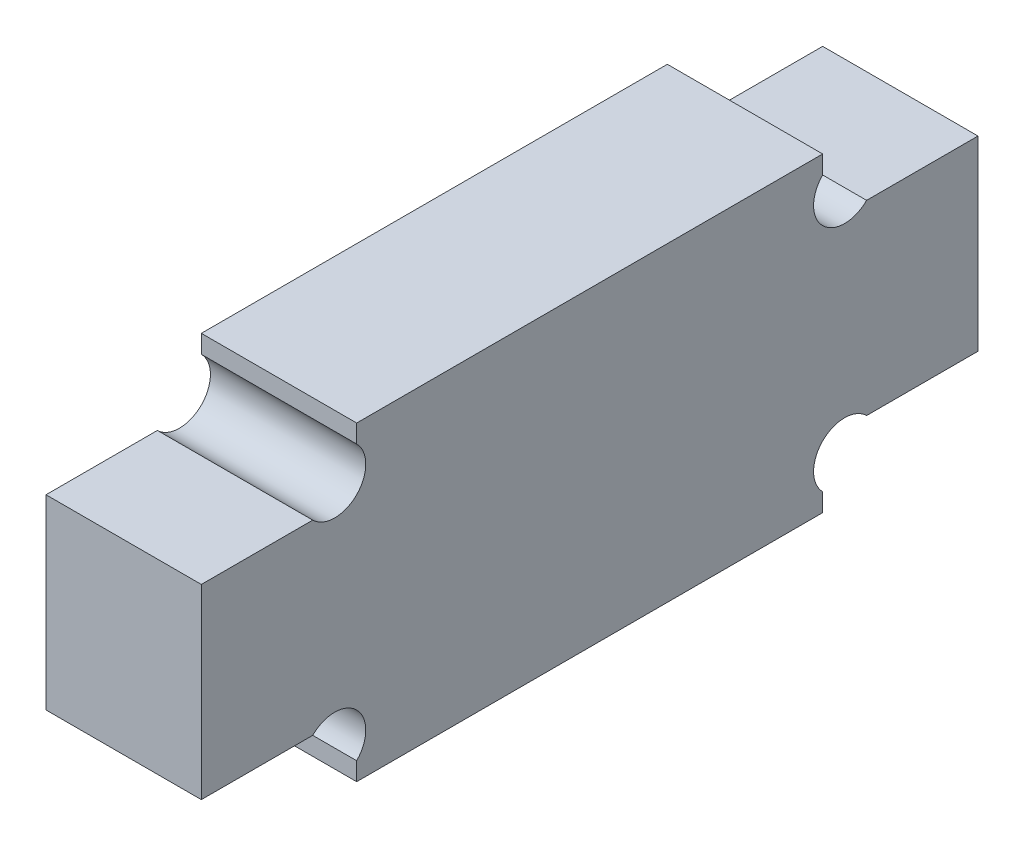
from build123d import *

# Parameters (mm, degrees)
SKETCH_1_W          = 25
SKETCH_1_H          = 10
EXTRUDE_1_DEPTH     = 5
SKETCH_2_W          = 5
SKETCH_2_H          = 2
CUT_EXTRUDE_1_DEPTH = 10
SKETCH_4_R          = 1
CUT_EXTRUDE_2_DEPTH = 10


with BuildPart() as part:
    # 스케치1 → 보스-돌출1 (new body)
    with BuildSketch(Plane(origin=(0, 0, 0), x_dir=(0, 0, -1), z_dir=(1, 0, 0))):
        with Locations((12.5, 5)):
            Rectangle(SKETCH_1_W, SKETCH_1_H)
    extrude(amount=EXTRUDE_1_DEPTH)

    # 스케치2 → 컷-돌출1 (cut)
    with BuildSketch(Plane.ZY):
        with Locations((-2.5, 1)):
            Rectangle(SKETCH_2_W, SKETCH_2_H)
        with Locations((-2.5, 9)):
            Rectangle(SKETCH_2_W, SKETCH_2_H)
        with Locations((-22.5, 9)):
            Rectangle(SKETCH_2_W, SKETCH_2_H)
        with Locations((-22.5, 1)):
            Rectangle(SKETCH_2_W, SKETCH_2_H)
    extrude(amount=-CUT_EXTRUDE_1_DEPTH, mode=Mode.SUBTRACT)

    # 스케치4 → 컷-돌출2 (cut)
    with BuildSketch(Plane.ZY):
        with Locations((-4.292893219, 8.707106781)):
            Circle(SKETCH_4_R)
        with Locations((-4.292893219, 1.292893219)):
            Circle(SKETCH_4_R)
        with Locations((-20.707106781, 1.292893219)):
            Circle(SKETCH_4_R)
        with Locations((-20.707106781, 8.707106781)):
            Circle(SKETCH_4_R)
    extrude(amount=-CUT_EXTRUDE_2_DEPTH, mode=Mode.SUBTRACT)


solid = part.part
